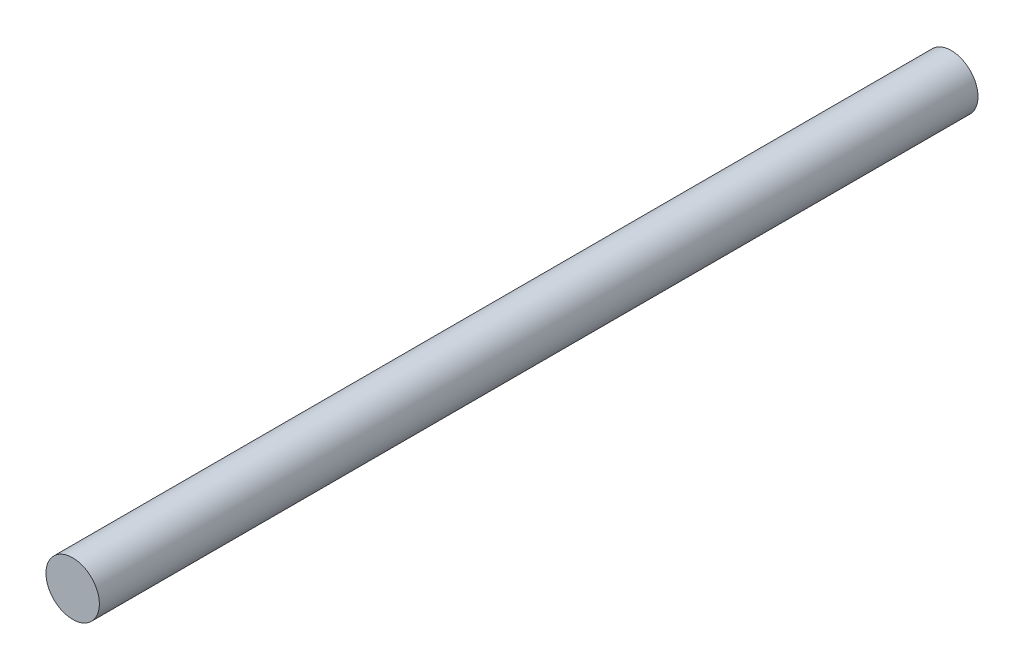
from build123d import *

# Parameters (mm, degrees)
BOSS_EXTRUDE1_DEPTH      = 10
BOSS_EXTRUDE1_DEPTH_BACK = 64
SKETCH1_R                = 2.25


with BuildPart() as part:
    # Sketch1 → Boss-Extrude1 (new, two sides: drawn at the far end of the back side and taken through both)
    with BuildSketch(Plane.XY.offset(-BOSS_EXTRUDE1_DEPTH_BACK)):
        Circle(SKETCH1_R)
    extrude(amount=BOSS_EXTRUDE1_DEPTH + BOSS_EXTRUDE1_DEPTH_BACK)


solid = part.part
